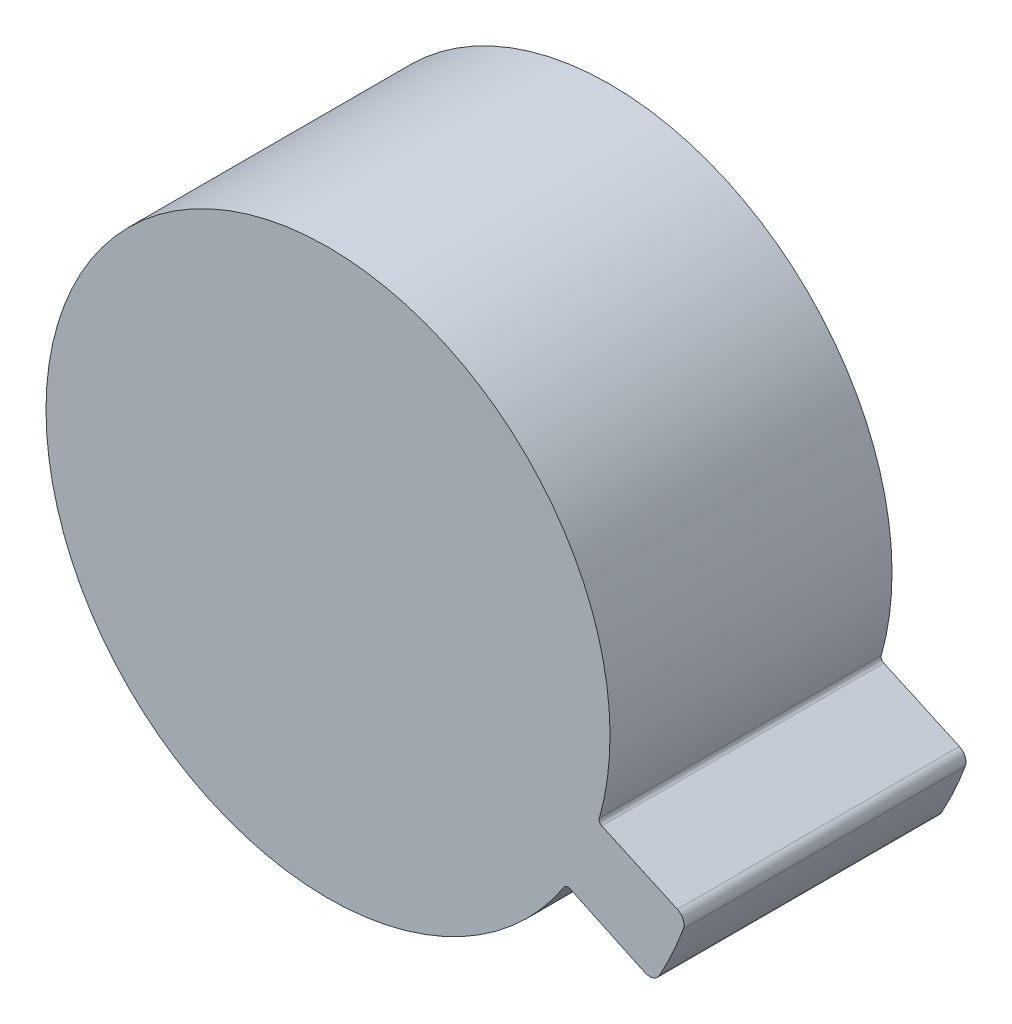
from build123d import *

# Parameters (mm, degrees)
BOSS_EXTRU_3_DEPTH = 12.5


with BuildPart() as part:
    # Esquisse1 → Boss.-Extru.3 (new body)
    with BuildSketch(Plane.XY):
        with BuildLine():
            Line((15.485185595, -5.176669047), (12.134231543, -3.650742984))
            ThreePointArc((12.134231543, -3.650742984), (12.035609724, -3.552721892), (12.024721053, -3.414100701))
            ThreePointArc((12.024721053, -3.414100701), (-11.374079439, 5.184623122), (10.464430261, -6.837082661))
            ThreePointArc((10.464430261, -6.837082661), (10.577237298, -6.754079946), (10.716830338, -6.765422852))
            Line((10.716830338, -6.765422852), (14.040747626, -8.325354826))
            ThreePointArc((14.040747626, -8.325354826), (14.40745115, -8.348324263), (14.690843755, -8.114470246))
            ThreePointArc((14.690843755, -8.114470246), (15.262737454, -6.979567539), (15.747114807, -5.80464408))
            ThreePointArc((15.747114807, -5.80464408), (15.739440197, -5.439232144), (15.485185595, -5.176669047))
        make_face()
    extrude(amount=BOSS_EXTRU_3_DEPTH)


solid = part.part
